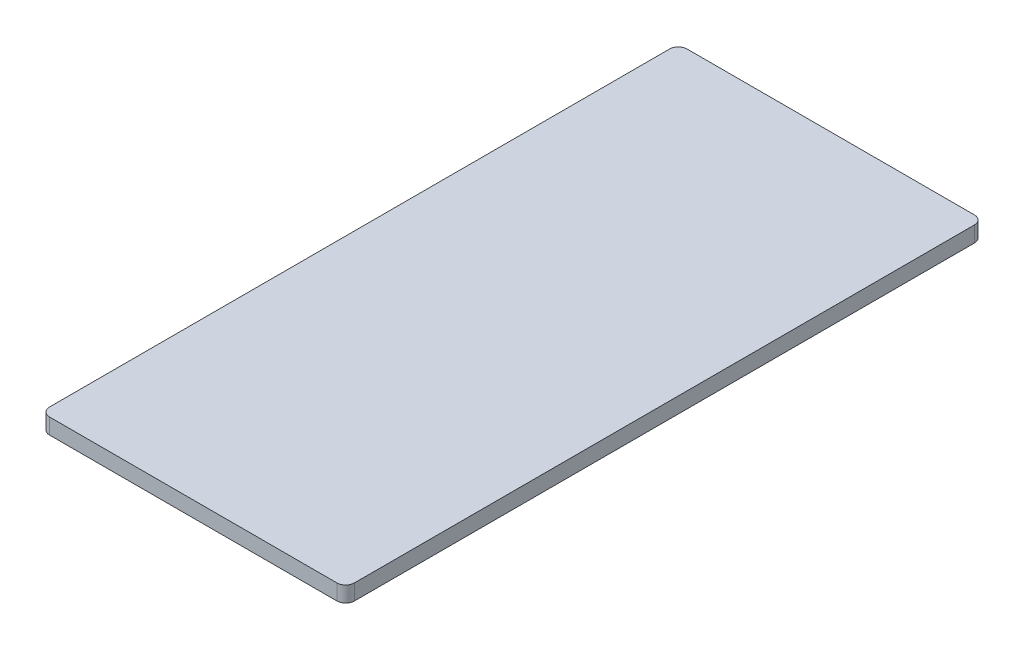
from build123d import *

# Parameters (mm, degrees)
SKETCH_1_W      = 350
SKETCH_1_H      = 732
EXTRUDE_1_DEPTH = 18
FILLET_1_R      = 10


with BuildPart() as part:
    # 草图1 → 凸台-拉伸1 (new body)
    with BuildSketch(Plane(origin=(0, 0, 0), x_dir=(1, 0, 0), z_dir=(0, 1, 0))):
        Rectangle(SKETCH_1_W, SKETCH_1_H)
    extrude(amount=EXTRUDE_1_DEPTH)

    # 圆角1
    fillet_1_edges = [part.edges().sort_by_distance(p)[0] for p in [
        (-175, 9, -366),
        (175, 9, -366),
        (175, 9, 366),
        (-175, 9, 366),
    ]]
    fillet(fillet_1_edges, radius=FILLET_1_R)


solid = part.part
